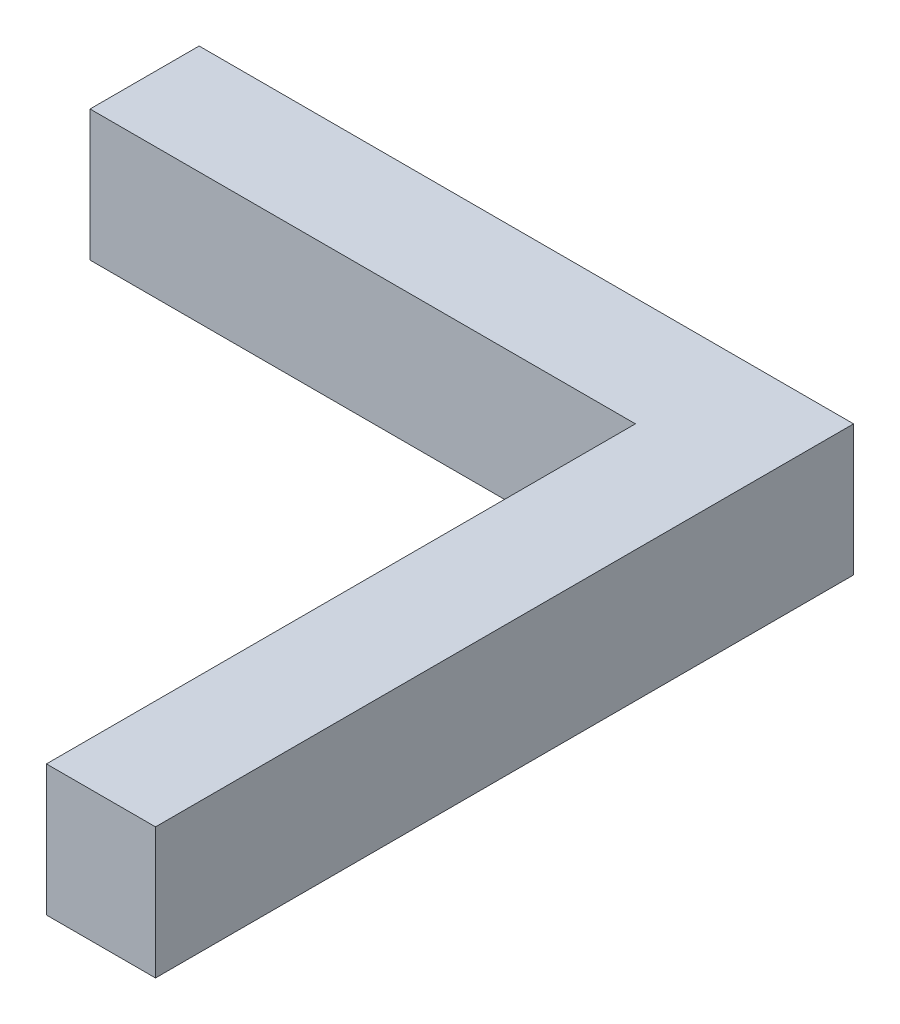
from build123d import *

# Parameters (mm, degrees)
BOSS_EXTRUDE1_DEPTH = 12


with BuildPart() as part:
    # Sketch1 → Boss-Extrude1 (new body)
    with BuildSketch(Plane(origin=(0, 0, 0), x_dir=(1, 0, 0), z_dir=(0, 1, 0))):
        Polygon((0, 0), (60, 0), (60, -64), (50, -64), (50, -10), (0, -10), align=None)
    extrude(amount=BOSS_EXTRUDE1_DEPTH)


solid = part.part
